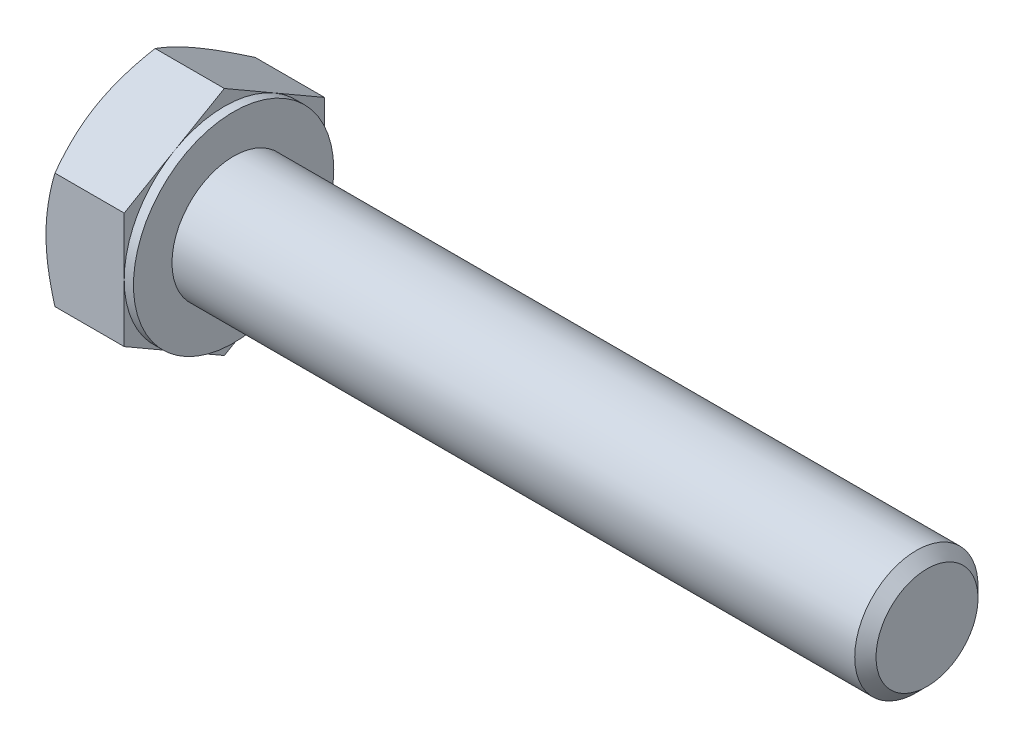
from build123d import *

# Parameters (mm, degrees)
BASEHEAD_DEPTH = 5.675
SKETCH4_W      = 0.6
SKETCH4_H      = 11.005553499


with BuildPart() as part:
    # Sketch1 → BaseHead (new body)
    with BuildSketch(Plane(origin=(0, 0, 0), x_dir=(0, 0, -1), z_dir=(1, 0, 0))):
        Polygon((6.5, 3.75277675), (6.5, -3.75277675), (0, -7.505553499), (-6.5, -3.75277675), (-6.5, 3.75277675), (0, 7.505553499), align=None)
    extrude(amount=BASEHEAD_DEPTH)

    # BodySke → BaseBody (revolve)
    with BuildSketch(Plane.XY, mode=Mode.PRIVATE) as basebody_sk:
        Polygon((0, 0), (50.675, 0), (50.675, 3.3095), (49.9845, 4), (0, 4), align=None)
    revolve(basebody_sk.sketch.rotate(Axis((0, 0, 0), (1, 0, 0)), 90), axis=Axis((0, 0, 0), (1, 0, 0)))

    # Sketch3 → HeadChamfer (revolve, cut)
    with BuildSketch(Plane.XY):
        Polygon((0, 6.5), (3.46730793, 12.505553499), (3.46730793, 17.505553499), (-10, 17.505553499), (-10, 6.5), align=None)
    revolve(axis=Axis((0, 0, 0), (1, 0, 0)), mode=Mode.SUBTRACT)

    # Sketch4 → BearingFace (revolve, cut)
    with BuildSketch(Plane.XY, mode=Mode.PRIVATE) as bearingface_sk:
        with Locations((5.375, 12.00277675)):
            Rectangle(SKETCH4_W, SKETCH4_H)
    revolve(bearingface_sk.sketch.rotate(Axis((0, 0, 0), (1, 0, 0)), 270), axis=Axis((0, 0, 0), (1, 0, 0)), mode=Mode.SUBTRACT)


solid = part.part
